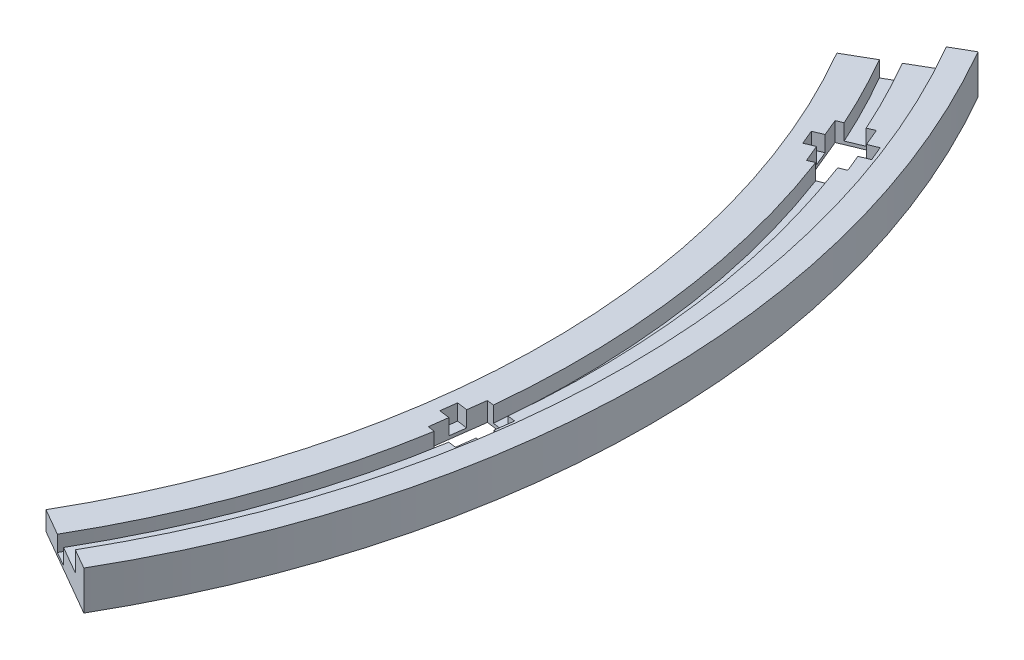
from build123d import *

# Parameters (mm, degrees)
AUFSATZ_LINEAR_AUSTRAGEN1_DEPTH = 3.6
SCHNITT_LINEAR_AUSTRAGEN1_DEPTH = 3
SCHNITT_LINEAR_AUSTRAGEN2_DEPTH = 190.652735282
SCHNITT_LINEAR_AUSTRAGEN3_DEPTH = 3
AUFSATZ_LINEAR_AUSTRAGEN2_DEPTH = 3.8


with BuildPart() as part:
    # Skizze1 → Aufsatz-Linear austragen1 (new body)
    with BuildSketch(Plane(origin=(0, 0, 0), x_dir=(1, 0, 0), z_dir=(0, 1, 0))):
        with BuildLine():
            Line((146.877908482, 84.8), (129.903810568, 75))
            ThreePointArc((129.903810568, 75), (150, 0), (129.903810568, -75))
            Line((129.903810568, -75), (146.877908482, -84.8))
            ThreePointArc((146.877908482, -84.8), (169.6, 0), (146.877908482, 84.8))
        make_face()
    extrude(amount=AUFSATZ_LINEAR_AUSTRAGEN1_DEPTH)

    # Skizze2 → Schnitt-Linear austragen1 (cut)
    with BuildSketch(Plane(origin=(0, 3.6, 0), x_dir=(1, 0, 0), z_dir=(0, 1, 0))):
        with BuildLine():
            Line((135.01336045, 77.95), (137.784641742, 79.55))
            ThreePointArc((137.784641742, 79.55), (159.1, 0), (137.784641742, -79.55))
            Line((137.784641742, -79.55), (135.01336045, -77.95))
            ThreePointArc((135.01336045, -77.95), (155.9, 0), (135.01336045, 77.95))
        make_face()
    extrude(amount=-SCHNITT_LINEAR_AUSTRAGEN1_DEPTH, mode=Mode.SUBTRACT)

    # Skizze3 → Schnitt-Linear austragen2 (cut, through all)
    with BuildSketch(Plane(origin=(0, 3.6, 0), x_dir=(1, 0, 0), z_dir=(0, 1, 0))):
        Polygon((140.825970611, 63.743987963), (146.369247806, 66.040088557), (150.19608213, 56.801293232), (144.652804935, 54.505192638), align=None)
        Polygon((153.830862043, -15.209072391), (159.779531212, -15.992229544), (158.474269289, -25.906678158), (152.525600121, -25.123521005), align=None)
    extrude(amount=-SCHNITT_LINEAR_AUSTRAGEN2_DEPTH, mode=Mode.SUBTRACT)

    # Skizze4 → Schnitt-Linear austragen3 (cut)
    with BuildSketch(Plane(origin=(0, 3.6, 0), x_dir=(1, 0, 0), z_dir=(0, 1, 0))):
        Polygon((140.317603559, 59.745042734), (149.556398885, 63.571877058), (150.704449182, 60.800238461), (141.465653857, 56.973404137), align=None)
        Polygon((151.391130648, -18.418077021), (161.305579262, -19.723338944), (160.914000685, -22.697673528), (150.999552071, -21.392411606), align=None)
    extrude(amount=-SCHNITT_LINEAR_AUSTRAGEN3_DEPTH, mode=Mode.SUBTRACT)

    # Skizze5 → Aufsatz-Linear austragen2 (add)
    with BuildSketch(Plane(origin=(0, 3.6, 0), x_dir=(1, 0, 0), z_dir=(0, 1, 0))):
        with BuildLine():
            Line((143.067396705, 82.6), (146.877908482, 84.8))
            ThreePointArc((146.877908482, 84.8), (169.6, 0), (146.877908482, -84.8))
            Line((146.877908482, -84.8), (143.067396705, -82.6))
            ThreePointArc((143.067396705, -82.6), (165.2, 0), (143.067396705, 82.6))
        make_face()
    extrude(amount=AUFSATZ_LINEAR_AUSTRAGEN2_DEPTH)


solid = part.part
